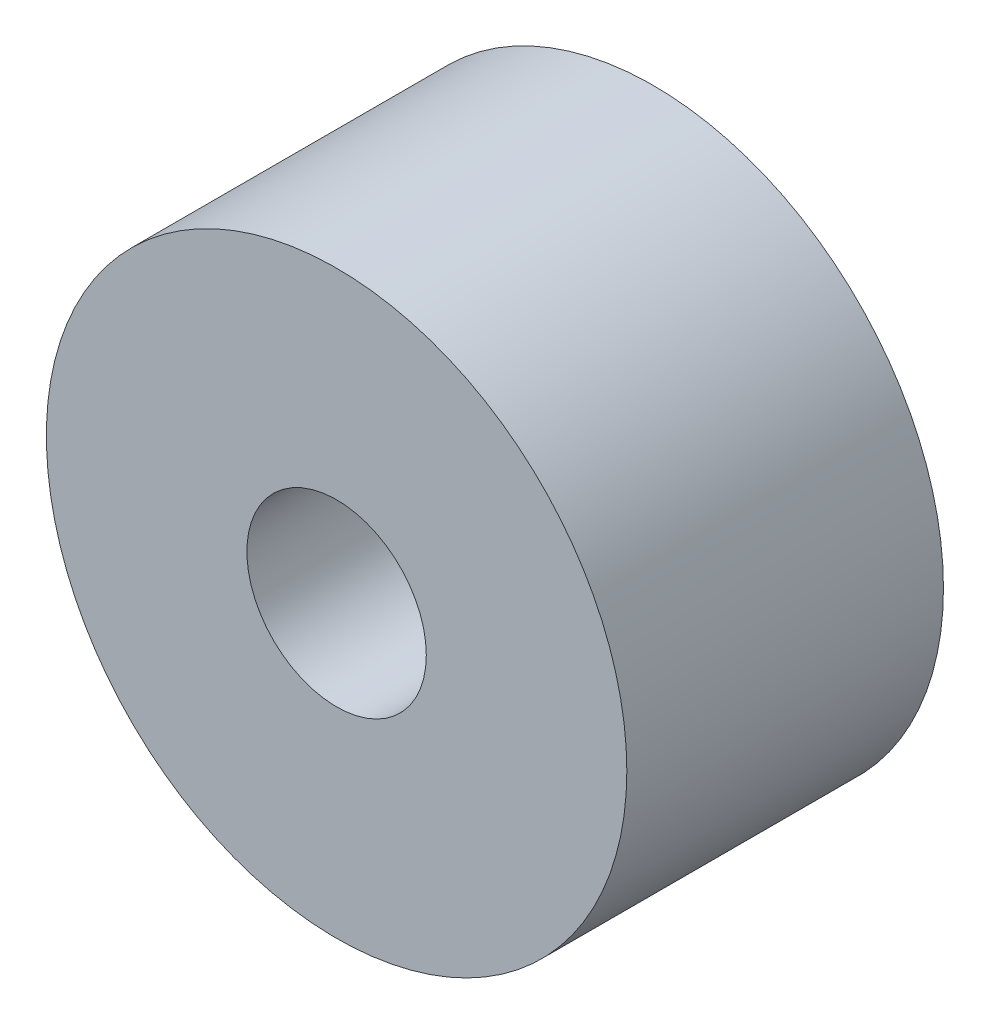
from build123d import *

# Parameters (mm, degrees)
SKETCH1_R            = 5.5
BOSS_EXTRUDE1_DEPTH  = 6
M3_CLEARANCE_HOLE1_D = 3.4


with BuildPart() as part:
    # Sketch1 → Boss-Extrude1 (new body)
    with BuildSketch(Plane.XY):
        Circle(SKETCH1_R)
    extrude(amount=BOSS_EXTRUDE1_DEPTH)

    # M3 Clearance Hole1 (through all)
    with Locations(Plane.XY.offset(6)):
        with Locations((0, 0)):
            Hole(M3_CLEARANCE_HOLE1_D / 2)


solid = part.part
